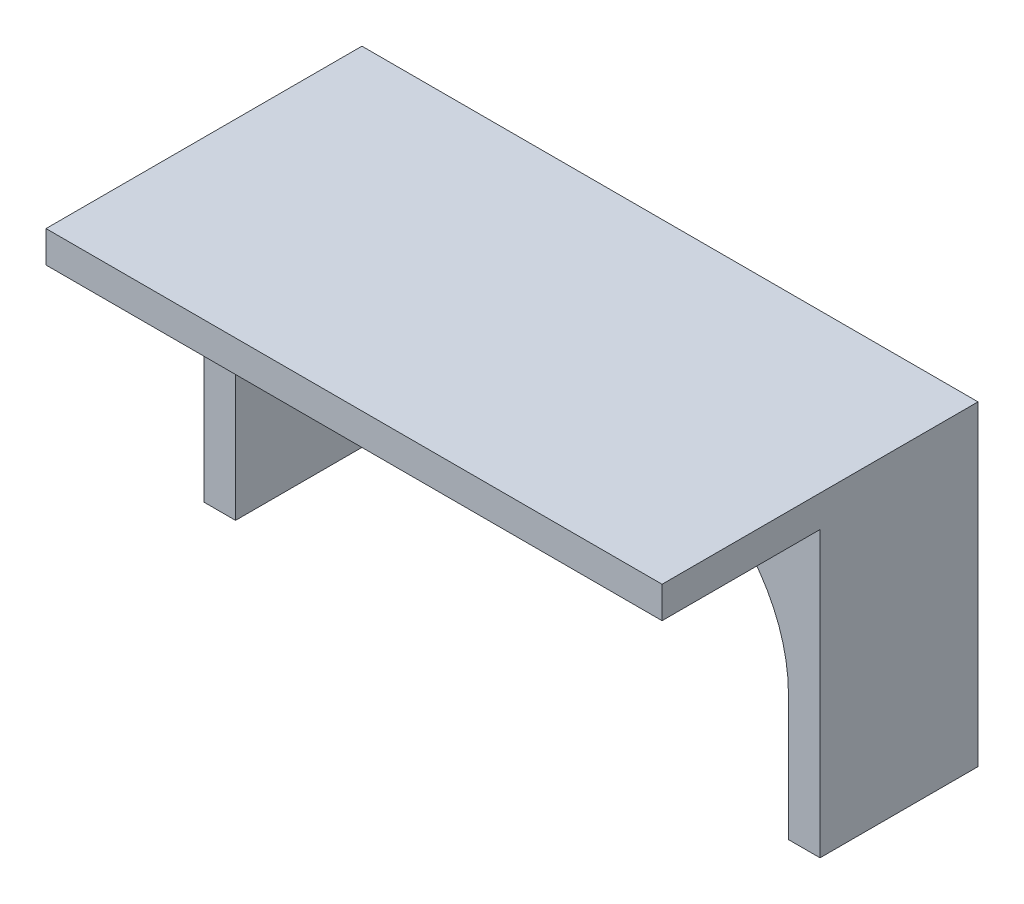
from build123d import *

# Parameters (mm, degrees)
BOSS_EXTRUDE1_DEPTH = 10
SKETCH2_W           = 39
SKETCH2_H           = 2
BOSS_EXTRUDE2_DEPTH = 10


with BuildPart() as part:
    # Sketch1 → Boss-Extrude1 (new body)
    with BuildSketch(Plane.XY):
        with BuildLine():
            Line((-19.5, 20), (-19.5, 0))
            Line((-19.5, 0), (-17.5, 0))
            Line((-17.5, 0), (-17.5, 8))
            ThreePointArc((-17.5, 8), (-14.571067812, 15.071067812), (-7.5, 18))
            Line((-7.5, 18), (7.5, 18))
            ThreePointArc((7.5, 18), (14.571067812, 15.071067812), (17.5, 8))
            Line((17.5, 8), (17.5, 0))
            Line((17.5, 0), (19.5, 0))
            Line((19.5, 0), (19.5, 20))
            Line((19.5, 20), (-19.5, 20))
        make_face()
    extrude(amount=BOSS_EXTRUDE1_DEPTH)

    # Sketch2 → Boss-Extrude2 (add)
    with BuildSketch(Plane.XY.offset(10)):
        with Locations((0, 19)):
            Rectangle(SKETCH2_W, SKETCH2_H)
    extrude(amount=BOSS_EXTRUDE2_DEPTH)


solid = part.part
